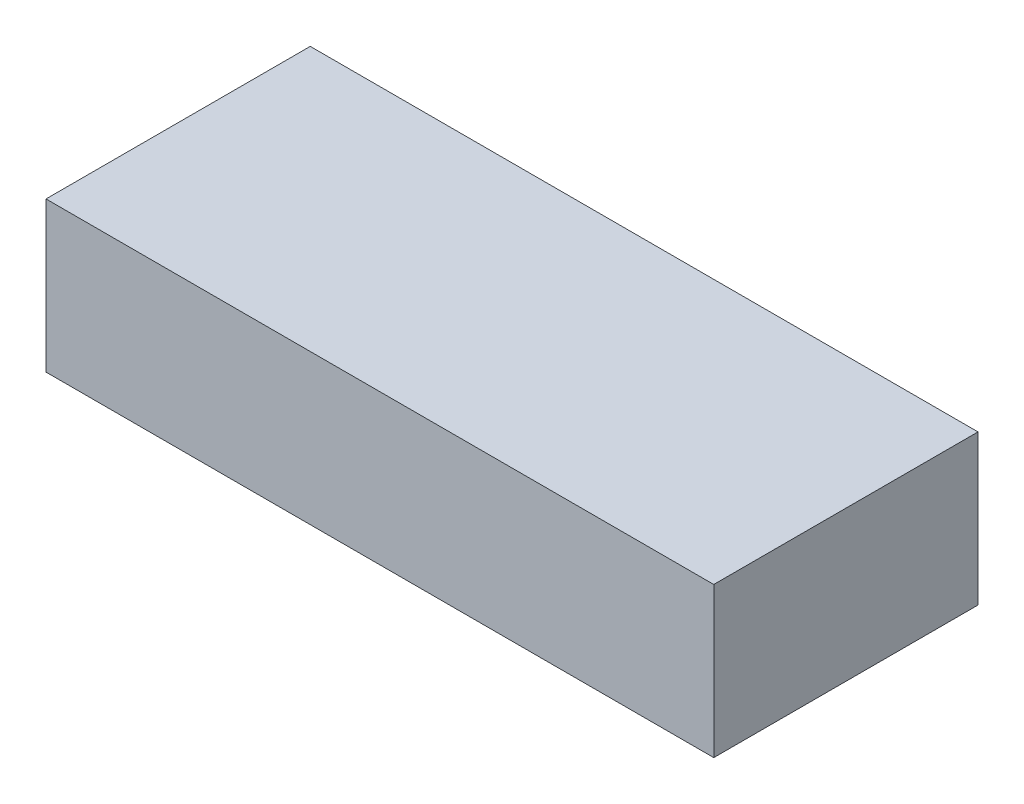
from build123d import *

# Parameters (mm, degrees)
SKETCH1_W           = 935
SKETCH1_H           = 370
BOSS_EXTRUDE1_DEPTH = 210


with BuildPart() as part:
    # Sketch1 → Boss-Extrude1 (new body)
    with BuildSketch(Plane(origin=(0, 0, 0), x_dir=(1, 0, 0), z_dir=(0, 1, 0))):
        with Locations((0, 185)):
            Rectangle(SKETCH1_W, SKETCH1_H)
    extrude(amount=-BOSS_EXTRUDE1_DEPTH)


solid = part.part
